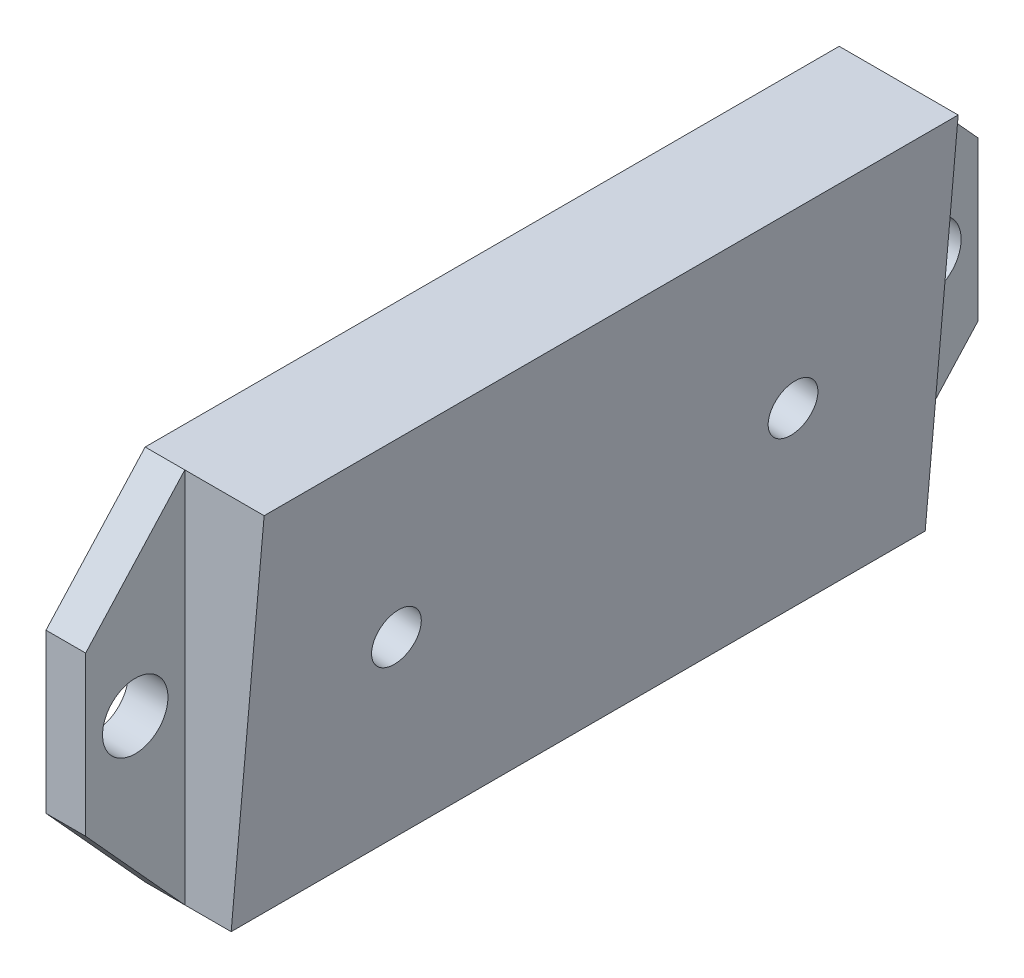
from build123d import *

# Parameters (mm, degrees)
DODANIE_WYCI_GNI_CIE1_DEPTH          = 12
DODANIE_WYCI_GNI_CIE2_DEPTH          = 10
WYTNIJ_WYCI_GNI_CIE1_DEPTH           = 8
WYTNIJ_WYCI_GNI_CIE2_DEPTH           = 88.749643874
OTW_R_GWINTOWANY_M61_D               = 5
OTW_R_GWINTOWANY_M61_DEPTH           = 14
OTW_R_GWINTOWANY_M61_TIP             = 1.502151548
OTW_R_GWINTOWANY_M61_ON_FACE_2_D     = 5
OTW_R_GWINTOWANY_M61_ON_FACE_2_DEPTH = 14
OTW_R_GWINTOWANY_M61_ON_FACE_2_TIP   = 1.502151548
OTW_R_POD_RUB_M61_D                  = 6.6


with BuildPart() as part:
    # Szkic1 → Dodanie-wyciągnięcie1 (new body)
    with BuildSketch(Plane(origin=(0, 0, 0), x_dir=(0, 0, -1), z_dir=(1, 0, 0))):
        Polygon((0, 34), (70, 34), (80, 23), (80, 7), (70, -4), (0, -4), (-10, 7), (-10, 23), align=None)
    extrude(amount=DODANIE_WYCI_GNI_CIE1_DEPTH)

    # Szkic3 → Dodanie-wyciągnięcie2 (add)
    with BuildSketch(Plane.ZY):
        with BuildLine():
            Line((-55, 20), (-15, 20))
            ThreePointArc((-15, 20), (-10, 15), (-15, 10))
            Line((-15, 10), (-55, 10))
            ThreePointArc((-55, 10), (-60, 15), (-55, 20))
        make_face()
    extrude(amount=DODANIE_WYCI_GNI_CIE2_DEPTH)

    # Szkic6 → Wytnij-wyciągnięcie1 (cut)
    with BuildSketch(Plane(origin=(12, 0, 0), x_dir=(0, 0, -1), z_dir=(1, 0, 0))):
        Polygon((0, 34), (0, -4), (-10, 7), (-10, 23), align=None)
        Polygon((70, 34), (70, -4), (80, 7), (80, 23), align=None)
    extrude(amount=-WYTNIJ_WYCI_GNI_CIE1_DEPTH, mode=Mode.SUBTRACT)

    # Szkic7 → Wytnij-wyciągnięcie2 (cut, through all)
    with BuildSketch(Plane.XY):
        Polygon((12, -4), (8.675430786, -4), (12, 34), align=None)
    extrude(amount=-WYTNIJ_WYCI_GNI_CIE2_DEPTH, mode=Mode.SUBTRACT)

    # Otwór gwintowany M61
    with Locations(Plane(origin=(10.344040888, 15.072300736, -15), x_dir=(0.087155742748, 0.996194698092, 0), z_dir=(0.996194698092, -0.087155742748, 0))):
        with Locations((0, 0)):
            Hole(OTW_R_GWINTOWANY_M61_D / 2, depth=OTW_R_GWINTOWANY_M61_DEPTH)
            with Locations((0, 0, -(OTW_R_GWINTOWANY_M61_DEPTH + OTW_R_GWINTOWANY_M61_TIP / 2))):  # 118° drill point
                Cone(0, OTW_R_GWINTOWANY_M61_D / 2, OTW_R_GWINTOWANY_M61_TIP, mode=Mode.SUBTRACT)

    # Otwór gwintowany M61 on face 2
    with Locations(Plane(origin=(10.344040888, 15.072300736, -55), x_dir=(0.087155971833, 0.996194678049, 0), z_dir=(0.996194678049, -0.087155971833, 0))):
        with Locations((0, 0)):
            Hole(OTW_R_GWINTOWANY_M61_ON_FACE_2_D / 2, depth=OTW_R_GWINTOWANY_M61_ON_FACE_2_DEPTH)
            with Locations((0, 0, -(OTW_R_GWINTOWANY_M61_ON_FACE_2_DEPTH + OTW_R_GWINTOWANY_M61_ON_FACE_2_TIP / 2))):  # 118° drill point
                Cone(0, OTW_R_GWINTOWANY_M61_ON_FACE_2_D / 2, OTW_R_GWINTOWANY_M61_ON_FACE_2_TIP, mode=Mode.SUBTRACT)

    # Otwór pod śrubę M61 (through all)
    with Locations(Plane(origin=(4, 15, 5), x_dir=(0, 0, 1), z_dir=(1, 0, 0))):
        with Locations((0, 0), (-80, 0)):
            Hole(OTW_R_POD_RUB_M61_D / 2)


solid = part.part
